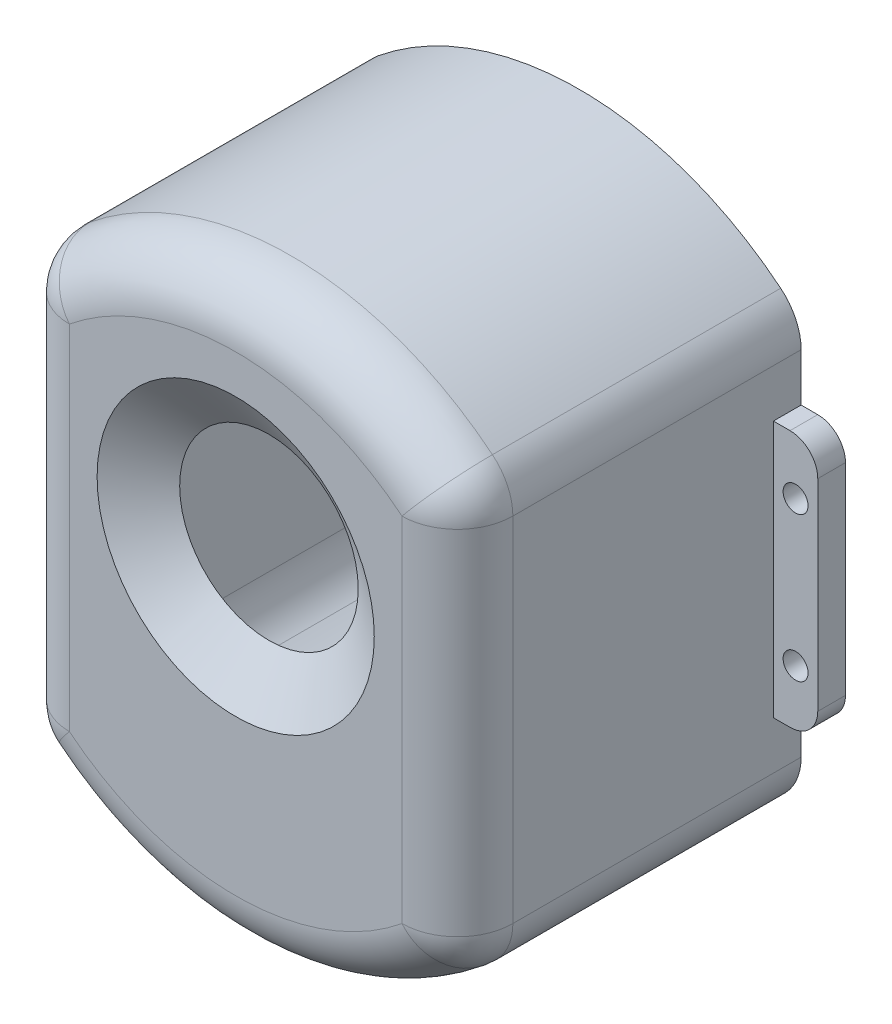
from build123d import *

# Parameters (mm, degrees)
BOSS_EXTRUDE1_DEPTH = 62
SHELL1_T            = -6
FILLET2_R           = 10
FILLET3_R           = 10
SKETCH4_W           = 42.2
SKETCH4_H           = 27.964545036
CUT_EXTRUDE1_DEPTH  = 1.9
SKETCH5_R           = 25
CUT_EXTRUDE2_DEPTH  = 91.55523235
DRAFT1_ANGLE        = 56
SKETCH6_W           = 8
SKETCH6_H           = 46.353363522
SKETCH6_R           = 2.25
BOSS_EXTRUDE2_DEPTH = 5
FILLET4_R           = 5


with BuildPart() as part:
    # Sketch2 → Boss-Extrude1 (new body)
    with BuildSketch(Plane.XY):
        with BuildLine():
            Line((-40, 36.306779105), (-40, -36.306779105))
            ThreePointArc((-40, -36.306779105), (0, -52.5), (40, -36.306779105))
            Line((40, -36.306779105), (40, 36.306779105))
            ThreePointArc((40, 36.306779105), (0, 52.5), (-40, 36.306779105))
        make_face()
    extrude(amount=BOSS_EXTRUDE1_DEPTH)

    # Shell1
    shell1_openings = [part.faces().sort_by_distance(p)[0] for p in [
        (0, 0, 0),
    ]]
    offset(amount=SHELL1_T, openings=shell1_openings, kind=Kind.INTERSECTION)

    # Fillet2
    fillet2_edges = [part.edges().sort_by_distance(p)[0] for p in [
        (0, -52.5, 62),
        (40, 0, 62),
        (0, 52.5, 62),
        (40, 36.306779105, 31),
        (40, -36.306779105, 31),
        (-40, -36.306779105, 31),
        (-40, 36.306779105, 31),
        (-40, 0, 62),
    ]]
    fillet(fillet2_edges, radius=FILLET2_R)

    # Fillet3
    fillet3_edges = [part.edges().sort_by_distance(p)[0] for p in [
        (34, 33.681390875, 28),
        (-34, 33.681390875, 28),
        (-34, -33.681390875, 28),
        (34, -33.681390875, 28),
    ]]
    fillet(fillet3_edges, radius=FILLET3_R)

    # Sketch4 → Cut-Extrude1 (cut)
    with BuildSketch(Plane.XY):
        with Locations((0, -42.064156307)):
            Rectangle(SKETCH4_W, SKETCH4_H)
    extrude(amount=CUT_EXTRUDE1_DEPTH, mode=Mode.SUBTRACT)

    # Sketch5 → Cut-Extrude2 (cut, through all)
    with BuildSketch(Plane.XY.offset(62)):
        with Locations((0, 10.5)):
            Circle(SKETCH5_R)
    extrude(amount=-CUT_EXTRUDE2_DEPTH, mode=Mode.SUBTRACT)

    # Draft1
    draft1_faces = [part.faces().sort_by_distance(p)[0] for p in [
        (-25, 10.5, 59),
    ]]
    draft(draft1_faces, Plane(origin=(0, -5, 62), x_dir=(1, 0, 0), z_dir=(0, 0, 1)), DRAFT1_ANGLE)

    # Sketch6 → Boss-Extrude2 (add)
    # profile 1 of 2: a face of its own
    with BuildSketch(Plane.XY):
        with Locations((44, 0)):
            Rectangle(SKETCH6_W, SKETCH6_H)
        with Locations((44, 13.05590564)):
            Circle(SKETCH6_R, mode=Mode.SUBTRACT)
        with Locations((44, -13.05590564)):
            Circle(SKETCH6_R, mode=Mode.SUBTRACT)
    # profile 2 of 2: a face of its own
    with BuildSketch(Plane.XY):
        with Locations((-44, 0)):
            Rectangle(SKETCH6_W, SKETCH6_H)
        with Locations(Location((-44, -13.05590564, 0), (0, 0, 180))):
            Circle(SKETCH6_R, mode=Mode.SUBTRACT)
        with Locations(Location((-44, 13.05590564, 0), (0, 0, 180))):
            Circle(SKETCH6_R, mode=Mode.SUBTRACT)
    extrude(amount=BOSS_EXTRUDE2_DEPTH)

    # Fillet4
    fillet4_edges = [part.edges().sort_by_distance(p)[0] for p in [
        (48, -23.176681761, 2.5),
        (48, 23.176681761, 2.5),
        (-48, 23.176681761, 2.5),
        (-48, -23.176681761, 2.5),
    ]]
    fillet(fillet4_edges, radius=FILLET4_R)


solid = part.part
